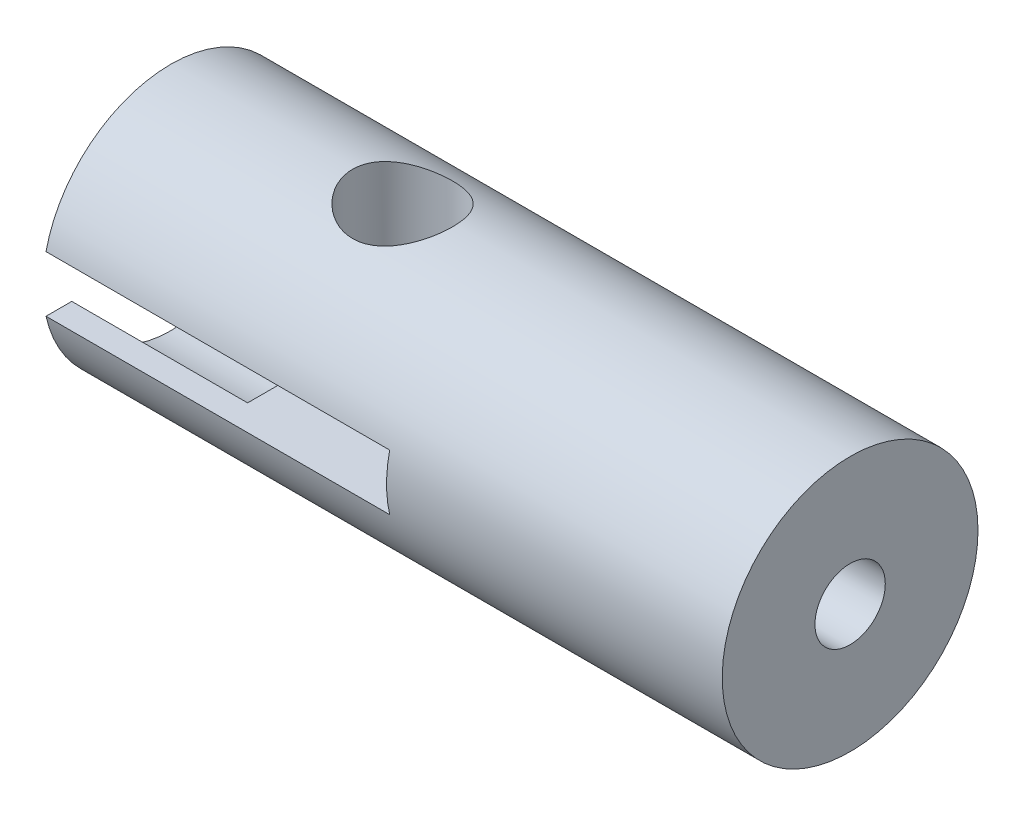
from build123d import *
from build123d.topology import SkipClean

# Parameters (mm, degrees)
SKETCH1_W                   = 155
SKETCH1_H                   = 16
CUT_EXTRUDE1_DEPTH          = 81.735679845
CUT_EXTRUDE1_DEPTH_BACK     = 81.735679845
SKETCH2_R                   = 6.25
SKETCH4_W                   = 50
SKETCH4_H                   = 7
CUT_EXTRUDE3_DEPTH          = 38
BOSS_EXTRUDE1_DEPTH         = 5
SKETCH24_R                  = 12.875
CUT_EXTRUDE12_DEPTH         = 22
SKETCH12_R                  = 16
SKETCH12_R_2                = 10
CUT_EXTRUDE6_DEPTH          = 35
SKETCH13_R                  = 6
BOSS_EXTRUDE2_DEPTH         = 15
CHAMFER2_SIZE               = 0.5
SKETCH17_R                  = 16
SKETCH17_R_2                = 12.5
CUT_EXTRUDE9_DEPTH          = 75
SKETCH14_W                  = 1
SKETCH14_H                  = 1
BOSS_EXTRUDE3_DEPTH         = 35
CIRPATTERN1_COUNT           = 32
CUT_EXTRUDE10_DEPTH         = 96.227359548
CUT_EXTRUDE10_DEPTH_BACK    = 96.227359548
SKETCH20_W                  = 129.677908588
SKETCH20_H                  = 32
BOSS_EXTRUDE4_START         = 30
SKETCH22_R                  = 16
BOSS_EXTRUDE4_DEPTH         = 30
M10X1_25_TAPPED_HOLE1_D     = 8.8
M10X1_25_TAPPED_HOLE1_DEPTH = 30
M10X1_25_TAPPED_HOLE1_TIP   = 2.643786724


with BuildPart() as part:
    # Sketch1 → Revolve1 (revolve)
    with BuildSketch(Plane(origin=(0, 0, 0), x_dir=(1, 0, 0), z_dir=(0, 1, 0))):
        with Locations((0, -8)):
            Rectangle(SKETCH1_W, SKETCH1_H)
    revolve(axis=Axis((-77.5, 0, 0), (1, 0, 0)))

    # Sketch2 → Cut-Extrude1 (cut, two sides: drawn at the far end of the back side and taken through both)
    with BuildSketch(Plane(origin=(0, 0, 0), x_dir=(1, 0, 0), z_dir=(0, 1, 0)).offset(-CUT_EXTRUDE1_DEPTH_BACK)):
        with Locations(Location((-53.5, 0, 0), (0, 0, 270))):
            Circle(SKETCH2_R)
    extrude(amount=CUT_EXTRUDE1_DEPTH + CUT_EXTRUDE1_DEPTH_BACK, mode=Mode.SUBTRACT)

    # Sketch4 → Cut-Extrude3 (cut)
    with BuildSketch(Plane.ZY.offset(77.5)):
        Rectangle(SKETCH4_W, SKETCH4_H)
    extrude(amount=-CUT_EXTRUDE3_DEPTH, mode=Mode.SUBTRACT)

    # Sketch6 → Boss-Extrude1 (add)
    with BuildSketch(Plane.ZY.offset(77.5)):
        with BuildLine():
            Line((-15.612494996, 3.5), (15.612494996, 3.5))
            ThreePointArc((15.612494996, 3.5), (0, 16), (-15.612494996, 3.5))
        make_face()
        with BuildLine():
            Line((15.612494996, -3.5), (-15.612494996, -3.5))
            ThreePointArc((-15.612494996, -3.5), (0, -16), (15.612494996, -3.5))
        make_face()
    extrude(amount=BOSS_EXTRUDE1_DEPTH)

    # Sketch24 → Cut-Extrude12 (cut)
    with BuildSketch(Plane.ZY.offset(82.5)):
        Circle(SKETCH24_R)
    extrude(amount=-CUT_EXTRUDE12_DEPTH, mode=Mode.SUBTRACT)

    # Sketch12 → Cut-Extrude6 (cut)
    with BuildSketch(Plane(origin=(77.5, 0, 0), x_dir=(0, 0, -1), z_dir=(1, 0, 0))):
        with Locations(Location((0, 0, 0), (0, 0, 167.364374907))):
            Circle(SKETCH12_R)
        Circle(SKETCH12_R_2, mode=Mode.SUBTRACT)
    extrude(amount=-CUT_EXTRUDE6_DEPTH, mode=Mode.SUBTRACT)

    # Sketch13 → Boss-Extrude2 (add)
    with BuildSketch(Plane(origin=(77.5, 0, 0), x_dir=(0, 0, -1), z_dir=(1, 0, 0))):
        Circle(SKETCH13_R)
    extrude(amount=BOSS_EXTRUDE2_DEPTH)

    # Chamfer2
    chamfer2_edges = [part.edges().sort_by_distance(p)[0] for p in [
        (92.5, 0, 6),
    ]]
    chamfer(chamfer2_edges, length=CHAMFER2_SIZE)

    # Sketch17 → Cut-Extrude9 (cut)
    with BuildSketch(Plane(origin=(47.5, 0, 0), x_dir=(0, 0, -1), z_dir=(1, 0, 0))):
        with Locations(Location((0, 0, 0), (0, 0, 167.364374907))):
            Circle(SKETCH17_R)
        Circle(SKETCH17_R_2, mode=Mode.SUBTRACT)
    extrude(amount=-CUT_EXTRUDE9_DEPTH, mode=Mode.SUBTRACT)

    # Sketch14 → Boss-Extrude3 (add)
    with SkipClean():  # the faces are left unmerged after this step: merging them gives an invalid solid
        with BuildSketch(Plane(origin=(77.5, 0, 0), x_dir=(0, 0, -1), z_dir=(1, 0, 0))):
            with Locations((0, 10)):
                Rectangle(SKETCH14_W, SKETCH14_H)
        boss_extrude3 = extrude(amount=-BOSS_EXTRUDE3_DEPTH)

    # CirPattern1: Boss-Extrude3 ×32 about axis
    with SkipClean():  # the faces are left unmerged after this step: merging them gives an invalid solid
        cirpattern1_axis = Axis((0, 0, 0), (1, 0, 0))
        for i in range(1, CIRPATTERN1_COUNT):
            add(boss_extrude3.rotate(cirpattern1_axis, i * 360 / CIRPATTERN1_COUNT))

    # Sketch20 → Cut-Extrude10 (cut, two sides: drawn at the far end of the back side and taken through both)
    with BuildSketch(Plane(origin=(0, 0, 0), x_dir=(1, 0, 0), z_dir=(0, 1, 0)).offset(-CUT_EXTRUDE10_DEPTH_BACK)):
        with Locations((37.338954294, 0)):
            Rectangle(SKETCH20_W, SKETCH20_H)
    extrude(amount=CUT_EXTRUDE10_DEPTH + CUT_EXTRUDE10_DEPTH_BACK, mode=Mode.SUBTRACT)

    # Sketch22 → Boss-Extrude4 (add)
    with SkipClean():  # the faces are left unmerged after this step: merging them gives an invalid solid
        with BuildSketch(Plane(origin=(-27.5, 0, 0), x_dir=(0, 0, -1), z_dir=(1, 0, 0)).offset(BOSS_EXTRUDE4_START)):
            with Locations(Location((0, 0, 0), (0, 0, 167.364374907))):
                Circle(SKETCH22_R)
        extrude(amount=-BOSS_EXTRUDE4_DEPTH)

    # M10x1.25 Tapped Hole1
    with Locations(Plane(origin=(2.5, 0, 0), x_dir=(0, 0, -1), z_dir=(1, 0, 0))):
        with Locations((0, 0)):
            Hole(M10X1_25_TAPPED_HOLE1_D / 2, depth=M10X1_25_TAPPED_HOLE1_DEPTH)
            with Locations((0, 0, -(M10X1_25_TAPPED_HOLE1_DEPTH + M10X1_25_TAPPED_HOLE1_TIP / 2))):  # 118° drill point
                Cone(0, M10X1_25_TAPPED_HOLE1_D / 2, M10X1_25_TAPPED_HOLE1_TIP, mode=Mode.SUBTRACT)


solid = part.part
